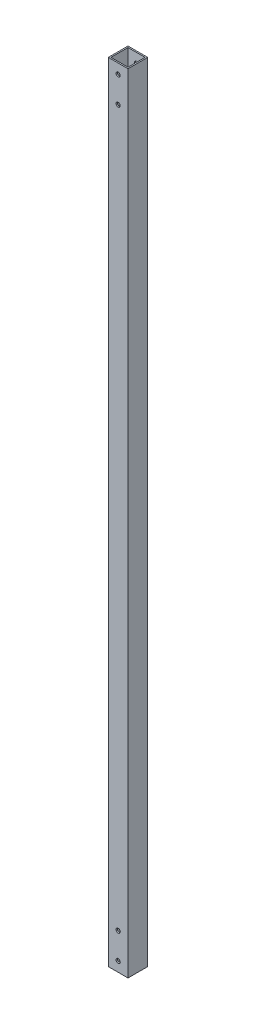
from build123d import *

# Parameters (mm, degrees)
SKETCH_1_W          = 15
SKETCH_1_H          = 15
SKETCH_1_W_2        = 13
SKETCH_1_H_2        = 13
EXTRUDE_1_DEPTH     = 600
SKETCH_2_R          = 1.6
CUT_EXTRUDE_1_DEPTH = 601.234329242


with BuildPart() as part:
    # 草图1 → 拉伸-薄壁1 (new body)
    with BuildSketch(Plane(origin=(0, 0, 0), x_dir=(1, 0, 0), z_dir=(0, 1, 0))):
        Rectangle(SKETCH_1_W, SKETCH_1_H)
        Rectangle(SKETCH_1_W_2, SKETCH_1_H_2, mode=Mode.SUBTRACT)
    extrude(amount=EXTRUDE_1_DEPTH)

    # 草图2 → 切除-拉伸1 (cut, through all)
    with BuildSketch(Plane.XY.offset(7.5)):
        with Locations((0, 7.5)):
            Circle(SKETCH_2_R)
        with Locations((0, 27.5)):
            Circle(SKETCH_2_R)
        with Locations((0, 572.5)):
            Circle(SKETCH_2_R)
        with Locations((0, 592.5)):
            Circle(SKETCH_2_R)
    extrude(amount=-CUT_EXTRUDE_1_DEPTH, mode=Mode.SUBTRACT)


solid = part.part
